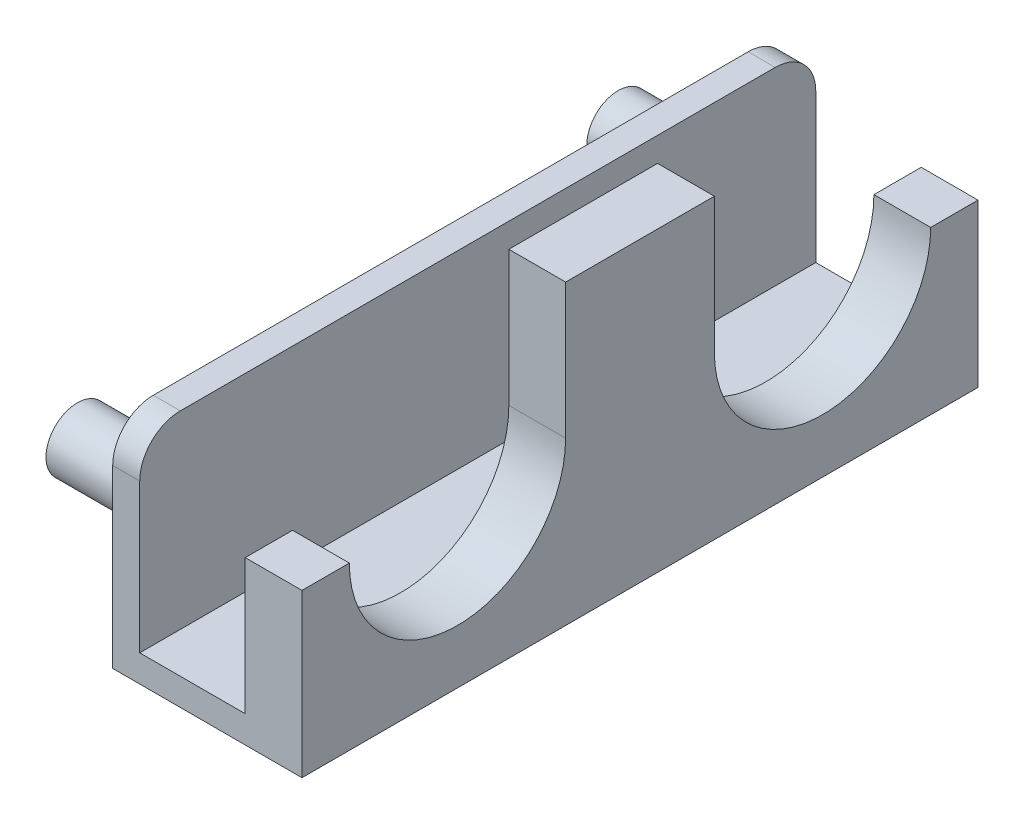
from build123d import *

# Parameters (mm, degrees)
SKETCH1_W               = 50
SKETCH1_H               = 16
BOSS_EXTRUDE1_DEPTH     = 2
SKETCH2_R               = 2.325
BOSS_EXTRUDE2_DEPTH     = 8
SKETCH3_W               = 50
SKETCH3_H               = 2
BOSS_EXTRUDE3_DEPTH     = 12
SKETCH4_W               = 4.2
SKETCH4_H               = 50
BOSS_EXTRUDE4_DEPTH     = 20
CUT_EXTRUDE1_DEPTH      = 121.124312029
CUT_EXTRUDE1_DEPTH_BACK = 4.2
SKETCH7_R               = 8
SKETCH8_W               = 16
SKETCH8_H               = 10
CUT_EXTRUDE2_DEPTH      = 4.2
FILLET1_R               = 3
SKETCH9_W               = 3.5
SKETCH9_H               = 10
CUT_EXTRUDE4_DEPTH      = 10


with BuildPart() as part:
    # Sketch1 → Boss-Extrude1 (new body)
    with BuildSketch(Plane(origin=(0, 0, 0), x_dir=(0, 0, -1), z_dir=(1, 0, 0))):
        with Locations((87.541975563, 21.779240865)):
            Rectangle(SKETCH1_W, SKETCH1_H)
    extrude(amount=BOSS_EXTRUDE1_DEPTH)

    # Sketch2 → Boss-Extrude2 (add)
    with BuildSketch(Plane.ZY):
        with Locations((-107.933354654, 21.779240865)):
            Circle(SKETCH2_R)
        with Locations((-67.933354654, 21.779240865)):
            Circle(SKETCH2_R)
    extrude(amount=BOSS_EXTRUDE2_DEPTH)

    # Sketch3 → Boss-Extrude3 (add)
    with BuildSketch(Plane(origin=(2, 0, 0), x_dir=(0, 0, -1), z_dir=(1, 0, 0))):
        with Locations((87.541975563, 14.779240865)):
            Rectangle(SKETCH3_W, SKETCH3_H)
    extrude(amount=BOSS_EXTRUDE3_DEPTH)

    # Sketch4 → Boss-Extrude4 (add)
    with BuildSketch(Plane(origin=(0, 15.779240865, 0), x_dir=(1, 0, 0), z_dir=(0, 1, 0))):
        with Locations((11.9, 87.541975563)):
            Rectangle(SKETCH4_W, SKETCH4_H)
    extrude(amount=BOSS_EXTRUDE4_DEPTH)

    # Sketch7 → Cut-Extrude1 (cut, two sides: drawn at the far end of the back side and taken through both)
    with BuildSketch(Plane(origin=(14, 0, 0), x_dir=(0, 0, -1), z_dir=(1, 0, 0)).offset(-CUT_EXTRUDE1_DEPTH_BACK)):
        with Locations(Location((74.041975563, 25.779240865, 0), (0, 0, 180))):
            Circle(SKETCH7_R)
        with Locations(Location((101.041975563, 25.779240865, 0), (0, 0, 180))):
            Circle(SKETCH7_R)
    extrude(amount=CUT_EXTRUDE1_DEPTH + CUT_EXTRUDE1_DEPTH_BACK, mode=Mode.SUBTRACT)

    # Sketch8 → Cut-Extrude2 (cut)
    with BuildSketch(Plane(origin=(14, 0, 0), x_dir=(0, 0, -1), z_dir=(1, 0, 0))):
        with Locations((74.041975563, 30.779240865)):
            Rectangle(SKETCH8_W, SKETCH8_H)
        with Locations((101.041975563, 30.779240865)):
            Rectangle(SKETCH8_W, SKETCH8_H)
    extrude(amount=-CUT_EXTRUDE2_DEPTH, mode=Mode.SUBTRACT)

    # Fillet1
    fillet1_edges = [part.edges().sort_by_distance(p)[0] for p in [
        (1, 29.779240865, -62.541975563),
        (1, 29.779240865, -112.541975563),
    ]]
    fillet(fillet1_edges, radius=FILLET1_R)

    # Sketch9 → Cut-Extrude4 (cut)
    with BuildSketch(Plane(origin=(14, 0, 0), x_dir=(0, 0, -1), z_dir=(1, 0, 0))):
        with Locations((64.291975563, 30.779240865)):
            Rectangle(SKETCH9_W, SKETCH9_H)
        with Locations((110.791975563, 30.779240865)):
            Rectangle(SKETCH9_W, SKETCH9_H)
    extrude(amount=-CUT_EXTRUDE4_DEPTH, mode=Mode.SUBTRACT)


solid = part.part
